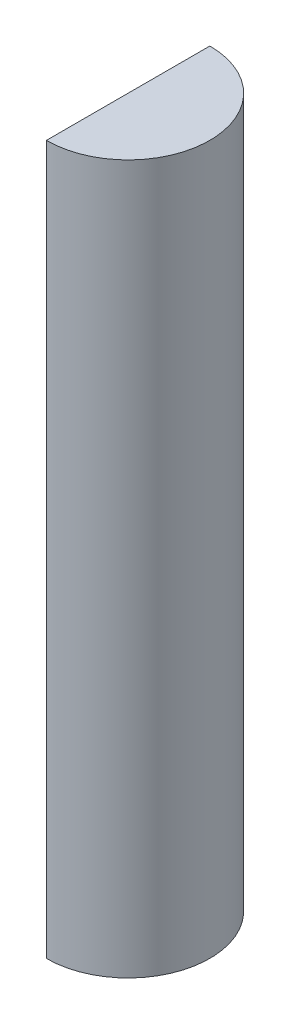
from build123d import *

# Parameters (mm, degrees)
SKETCH1_R           = 2.38125
BOSS_EXTRUDE1_DEPTH = 1.5875
SKETCH2_R           = 3.175
BOSS_EXTRUDE2_DEPTH = 1.5875
SKETCH3_R           = 2.38125
BOSS_EXTRUDE3_DEPTH = 19.05
SKETCH4_R           = 3.175
BOSS_EXTRUDE4_DEPTH = 1.5875
SKETCH5_R           = 2.38125
BOSS_EXTRUDE5_DEPTH = 1.5875
SKETCH9_W           = 27.857962544
SKETCH9_H           = 18.98631043
SKETCH9_R           = 2.38125
CUT_EXTRUDE4_DEPTH  = 28.662025878
SKETCH12_W          = 2.976246955
SKETCH12_H          = 4.951375607
CUT_EXTRUDE5_DEPTH  = 23.746254865


with BuildPart() as part:
    # Sketch1 → Boss-Extrude1 (new body)
    with BuildSketch(Plane(origin=(0, 0, 0), x_dir=(1, 0, 0), z_dir=(0, 1, 0))):
        with BuildLine():
            Line((9.398005644, 4.762076723), (-6.35, 4.7625))
            ThreePointArc((-6.35, 4.7625), (-11.020584629, 0.931152767), (-8.176363381, -4.398386414))
            ThreePointArc((-8.176363381, -4.398386414), (-5.292234705, -6.221263486), (-3.181508348, -8.901918869))
            ThreePointArc((-3.181508348, -8.901918869), (1.849687492, -11.693035316), (6.504625866, -8.311495529))
            ThreePointArc((6.504625866, -8.311495529), (8.146827792, -5.96033805), (10.67447942, -4.60544104))
            ThreePointArc((10.67447942, -4.60544104), (14.180390361, 0.643024113), (9.398005644, 4.762076723))
        make_face()
        with Locations(Location((-6.35, 0, 0), (0, 0, 270))):
            Circle(SKETCH1_R, mode=Mode.SUBTRACT)
        with Locations(Location((9.4615, 0, 0), (0, 0, 270))):
            Circle(SKETCH1_R, mode=Mode.SUBTRACT)
        with Locations(Location((1.524, -6.35, 0), (0, 0, 270))):
            Circle(SKETCH1_R, mode=Mode.SUBTRACT)
    extrude(amount=BOSS_EXTRUDE1_DEPTH)

    # Sketch2 → Boss-Extrude2 (add)
    with BuildSketch(Plane.XZ):
        with Locations(Location((1.524, 6.35, 0), (0, 0, 90))):
            Circle(SKETCH2_R)
    extrude(amount=BOSS_EXTRUDE2_DEPTH)

    # Sketch3 → Boss-Extrude3 (add)
    with BuildSketch(Plane(origin=(0, 0, 0), x_dir=(1, 0, 0), z_dir=(0, 1, 0))):
        with Locations(Location((1.524, -6.35, 0), (0, 0, 90))):
            Circle(SKETCH3_R)
    extrude(amount=BOSS_EXTRUDE3_DEPTH)

    # Sketch4 → Boss-Extrude4 (add)
    with BuildSketch(Plane(origin=(0, 19.05, 0), x_dir=(1, 0, 0), z_dir=(0, 1, 0))):
        with Locations(Location((1.524, -6.35, 0), (0, 0, 270))):
            Circle(SKETCH4_R)
    extrude(amount=-BOSS_EXTRUDE4_DEPTH)


with BuildPart() as body_2:
    # Sketch5 → Boss-Extrude5 (new body)
    with BuildSketch(Plane.XZ.offset(-17.4625)):
        with BuildLine():
            ThreePointArc((-8.176363381, 4.398386414), (-11.020584629, -0.931152767), (-6.35, -4.7625))
            Line((-6.35, -4.7625), (9.4615, -4.7625))
            ThreePointArc((9.4615, -4.7625), (14.184572051, -0.611552653), (10.67447942, 4.60544104))
            ThreePointArc((10.67447942, 4.60544104), (8.146827792, 5.96033805), (6.504625866, 8.311495529))
            ThreePointArc((6.504625866, 8.311495529), (1.849687492, 11.693035316), (-3.181508348, 8.901918869))
            ThreePointArc((-3.181508348, 8.901918869), (-5.292234705, 6.221263486), (-8.176363381, 4.398386414))
        make_face()
        with Locations(Location((-6.35, 0, 0), (0, 0, 90))):
            Circle(SKETCH5_R, mode=Mode.SUBTRACT)
        with Locations(Location((9.4615, 0, 0), (0, 0, 90))):
            Circle(SKETCH5_R, mode=Mode.SUBTRACT)
        with Locations(Location((1.524, 6.35, 0), (0, 0, 270))):
            Circle(SKETCH5_R, mode=Mode.SUBTRACT)
    extrude(amount=BOSS_EXTRUDE5_DEPTH)


with BuildPart() as cut_extrude4_tool:
    # Sketch9 → Cut-Extrude4 (new, through all)
    with BuildSketch(Plane.XZ.offset(1.5875)):
        with Locations((1.177973605, 3.738325546)):
            Rectangle(SKETCH9_W, SKETCH9_H)
        with Locations(Location((1.524, 6.35, 0), (0, 0, 270))):
            Circle(SKETCH9_R, mode=Mode.SUBTRACT)
    extrude(amount=-CUT_EXTRUDE4_DEPTH)


with BuildPart() as part_1:
    add(part.part)

    # Cut-Extrude4: cut by cut_extrude4_tool
    add(cut_extrude4_tool.part, mode=Mode.SUBTRACT)

    # Sketch12 → Cut-Extrude5 (cut, through all)
    with BuildSketch(Plane.XZ.offset(1.5875)):
        with Locations((0.035876522, 6.255562197)):
            Rectangle(SKETCH12_W, SKETCH12_H)
    extrude(amount=-CUT_EXTRUDE5_DEPTH, mode=Mode.SUBTRACT)


with BuildPart() as body_2_1:
    add(body_2.part)

    # Cut-Extrude4: cut by cut_extrude4_tool
    add(cut_extrude4_tool.part, mode=Mode.SUBTRACT)


solid = part_1.part
